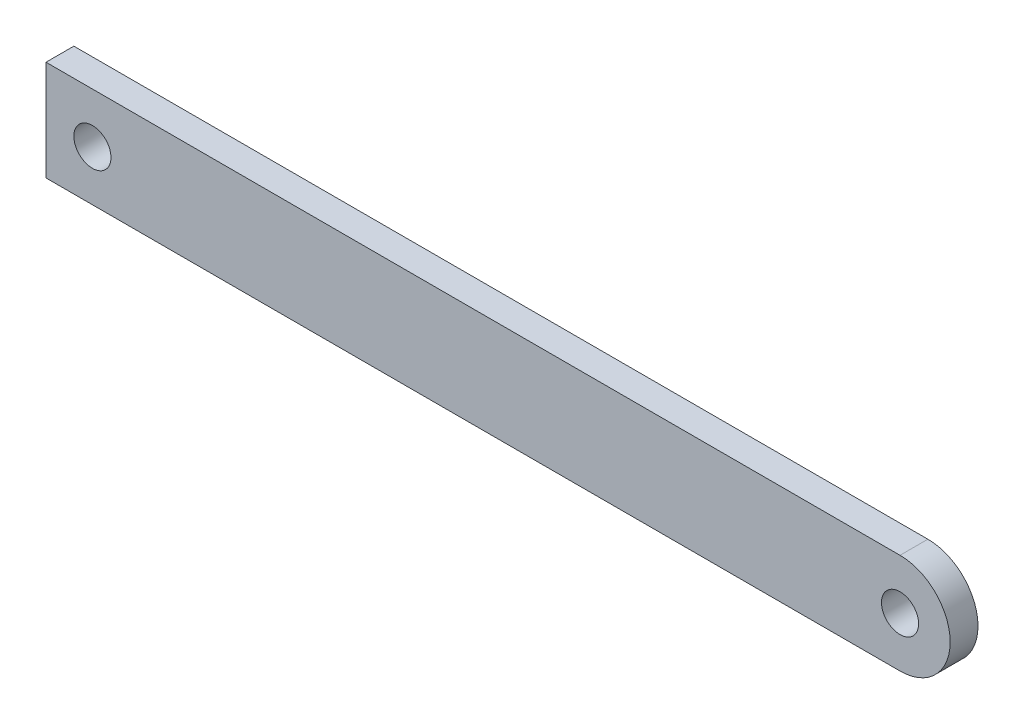
from build123d import *

# Parameters (mm, degrees)
SKETCH2_R           = 10
BOSS_EXTRUDE2_DEPTH = 15


with BuildPart() as part:
    # Sketch2 → Boss-Extrude2 (new body)
    with BuildSketch(Plane.XY):
        with BuildLine():
            Line((-230, 27), (230, 27))
            ThreePointArc((230, 27), (257, 0), (230, -27))
            Line((230, -27), (-230, -27))
            Line((-230, -27), (-230, 27))
        make_face()
        with Locations(Location((230, 0, 0), (0, 0, 180))):
            Circle(SKETCH2_R, mode=Mode.SUBTRACT)
        with Locations((-205, 0)):
            Circle(SKETCH2_R, mode=Mode.SUBTRACT)
    extrude(amount=-BOSS_EXTRUDE2_DEPTH)


solid = part.part
